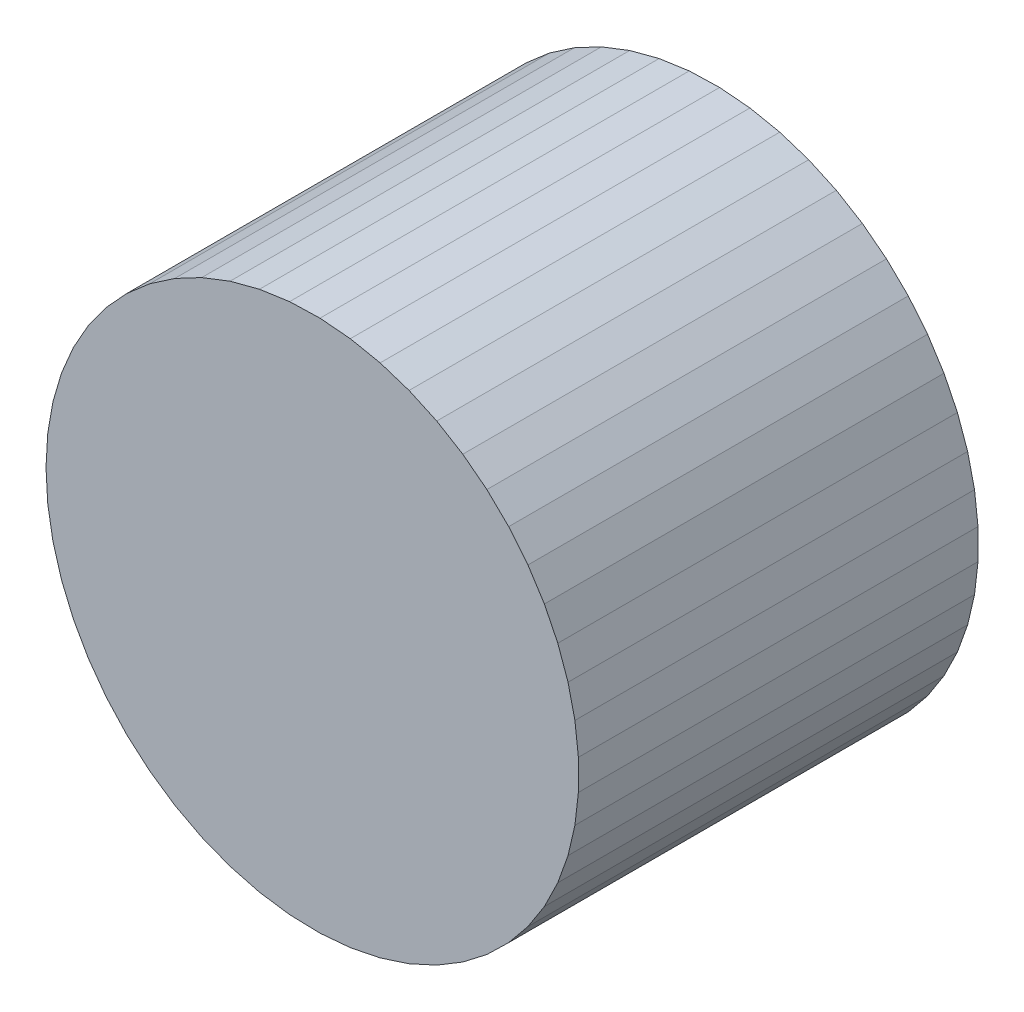
from build123d import *

# Parameters (mm, degrees)
TH_N_NGO_I_DEPTH      = 30
KHOANG_START          = 0.5
KHOANG_R_NG_K_N_DEPTH = 29


with BuildPart() as part:
    # Biên dạng ngoài theo phôi gốc → Thân ngoài (new body)
    with BuildSketch(Plane.XY):
        Polygon((-20, 0), (-19.869634628, -2.279828072), (-19.480237961, -4.52993536), (-18.83688736, -6.720988274), (-17.947967529, -8.824421883), (-16.825069428, -10.81281662), (-15.482831955, -12.66024971), (-13.938751221, -14.342636108), (-12.212957382, -15.83804512), (-10.327949524, -17.126981735), (-8.308300018, -18.192638397), (-6.180339813, -19.021131515), (-3.971809387, -19.601652145), (-1.711500168, -19.926635742), (0.571121037, -19.991844177), (2.846296787, -19.79642868), (5.084366798, -19.34293747), (7.25615406, -18.637279511), (9.333346367, -17.688657761), (11.288864136, -16.509437561), (13.097214699, -15.114992142), (14.734822273, -13.523497581), (16.180339813, -11.75570488), (17.414920807, -9.834658623), (18.422472, -7.785401821), (19.18985939, -5.634651184), (19.707077026, -3.410444021), (19.967382431, -1.141776204), (19.967382431, 1.141776204), (19.707077026, 3.410444021), (19.18985939, 5.634651184), (18.422472, 7.785401821), (17.414920807, 9.834658623), (16.180339813, 11.75570488), (14.734822273, 13.523497581), (13.097214699, 15.114992142), (11.288864136, 16.509437561), (9.333346367, 17.688657761), (7.25615406, 18.637279511), (5.084366798, 19.34293747), (2.846296787, 19.79642868), (0.571121037, 19.991844177), (-1.711500168, 19.926635742), (-3.971809387, 19.601652145), (-6.180339813, 19.021131515), (-8.308300018, 18.192638397), (-10.327949524, 17.126981735), (-12.212957382, 15.83804512), (-13.938751221, 14.342636108), (-15.482831955, 12.66024971), (-16.825069428, 10.81281662), (-17.947967529, 8.824421883), (-18.83688736, 6.720988274), (-19.480237961, 4.52993536), (-19.869634628, 2.279828072), align=None)
    extrude(amount=TH_N_NGO_I_DEPTH)

    # Biên dạng trong cách thành ngoài 0,3 mm → Khoang rỗng kín (cut)
    with BuildSketch(Plane.XY.offset(KHOANG_START)):
        Polygon((-19.57110405, -2.245574713), (-19.187557221, -4.461875439), (-18.553873062, -6.620008946), (-17.678308487, -8.691839218), (-16.572280884, -10.650359154), (-15.250209808, -12.470035553), (-13.729328155, -14.127144813), (-12.029463768, -15.600086212), (-10.172777176, -16.869657516), (-8.18347168, -17.919303894), (-6.087482929, -18.735347748), (-3.912134886, -19.30714798), (-1.68578577, -19.627248764), (0.562540114, -19.691476822), (2.8035326, -19.498996735), (5.007976532, -19.052318573), (7.147133827, -18.357263565), (9.193117142, -17.422893524), (11.119255066, -16.261390686), (12.900435448, -14.887896538), (14.513439179, -13.320313454), (15.937238693, -11.579081535), (17.153270721, -9.686898232), (18.145683289, -7.668429852), (18.901540756, -5.549993038), (19.410987854, -3.359203815), (19.667383194, -1.12462163), (19.667383194, 1.12462163), (19.410987854, 3.359203815), (18.901540756, 5.549993038), (18.145683289, 7.668429852), (17.153270721, 9.686898232), (15.937238693, 11.579081535), (14.513439179, 13.320313454), (12.900435448, 14.887896538), (11.119255066, 16.261390686), (9.193117142, 17.422893524), (7.147133827, 18.357263565), (5.007976532, 19.052318573), (2.8035326, 19.498996735), (0.562540114, 19.691476822), (-1.68578577, 19.627248764), (-3.912134886, 19.30714798), (-6.087482929, 18.735347748), (-8.18347168, 17.919303894), (-10.172777176, 16.869657516), (-12.029463768, 15.600086212), (-13.729328155, 14.127144813), (-15.250209808, 12.470035553), (-16.572280884, 10.650359154), (-17.678308487, 8.691839218), (-18.553873062, 6.620008946), (-19.187557221, 4.461875439), (-19.57110405, 2.245574713), (-19.699510574, 0), align=None)
    extrude(amount=KHOANG_R_NG_K_N_DEPTH, mode=Mode.SUBTRACT)


solid = part.part
